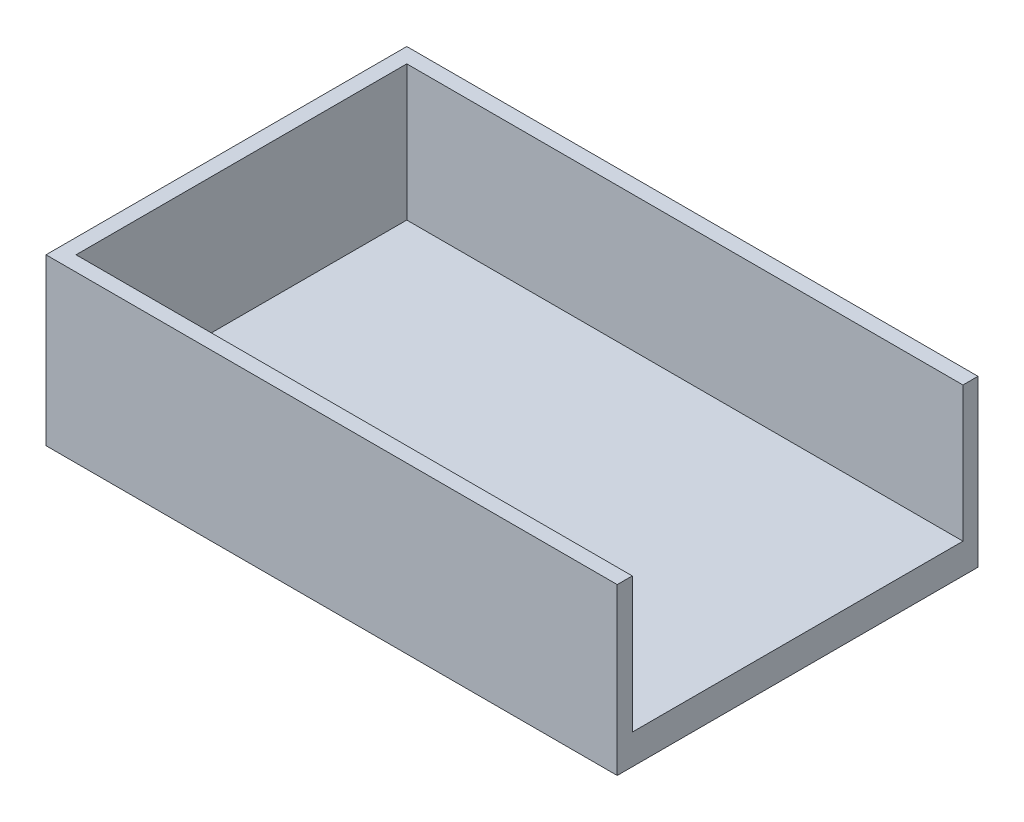
from build123d import *

# Parameters (mm, degrees)
SKETCH1_W           = 40
SKETCH1_H           = 24
BOSS_EXTRUDE1_DEPTH = 2
SKETCH2_W           = 40
SKETCH2_H           = 24
SKETCH2_W_2         = 36
SKETCH2_H_2         = 22
BOSS_EXTRUDE3_DEPTH = 9
SKETCH5_W           = 4
SKETCH5_H           = 3
CUT_EXTRUDE1_DEPTH  = 2
SKETCH6_W           = 24
SKETCH6_H           = 11
CUT_EXTRUDE2_DEPTH  = 2
SKETCH7_W           = 22
SKETCH7_H           = 9
CUT_EXTRUDE3_DEPTH  = 2
SKETCH8_W           = 1
SKETCH8_H           = 3
CUT_EXTRUDE4_DEPTH  = 2


with BuildPart() as part:
    # Sketch1 → Boss-Extrude1 (new body)
    with BuildSketch(Plane(origin=(0, 0, 0), x_dir=(1, 0, 0), z_dir=(0, 1, 0))):
        with Locations((20, 12)):
            Rectangle(SKETCH1_W, SKETCH1_H)
    extrude(amount=BOSS_EXTRUDE1_DEPTH)

    # Sketch2 → Boss-Extrude3 (add)
    with BuildSketch(Plane(origin=(0, 2, 0), x_dir=(1, 0, 0), z_dir=(0, 1, 0))):
        with Locations((20, 12)):
            Rectangle(SKETCH2_W, SKETCH2_H)
        with Locations((21, 12)):
            Rectangle(SKETCH2_W_2, SKETCH2_H_2, mode=Mode.SUBTRACT)
    extrude(amount=BOSS_EXTRUDE3_DEPTH)

    # Sketch5 → Cut-Extrude1 (cut)
    with BuildSketch(Plane(origin=(0, 2, 0), x_dir=(1, 0, 0), z_dir=(0, 1, 0))):
        with Locations((6, 2.5)):
            Rectangle(SKETCH5_W, SKETCH5_H)
    extrude(amount=-CUT_EXTRUDE1_DEPTH, mode=Mode.SUBTRACT)

    # Sketch6 → Cut-Extrude2 (cut)
    with BuildSketch(Plane(origin=(40, 0, 0), x_dir=(0, 0, -1), z_dir=(1, 0, 0))):
        with Locations((12, 5.5)):
            Rectangle(SKETCH6_W, SKETCH6_H)
    extrude(amount=-CUT_EXTRUDE2_DEPTH, mode=Mode.SUBTRACT)

    # Sketch7 → Cut-Extrude3 (cut)
    with BuildSketch(Plane(origin=(3, 0, 0), x_dir=(0, 0, -1), z_dir=(1, 0, 0))):
        with Locations((12, 6.5)):
            Rectangle(SKETCH7_W, SKETCH7_H)
    extrude(amount=-CUT_EXTRUDE3_DEPTH, mode=Mode.SUBTRACT)

    # Sketch8 → Cut-Extrude4 (cut)
    with BuildSketch(Plane(origin=(0, 2, 0), x_dir=(1, 0, 0), z_dir=(0, 1, 0))):
        with Locations((3.5, 2.5)):
            Rectangle(SKETCH8_W, SKETCH8_H)
    extrude(amount=-CUT_EXTRUDE4_DEPTH, mode=Mode.SUBTRACT)


solid = part.part
